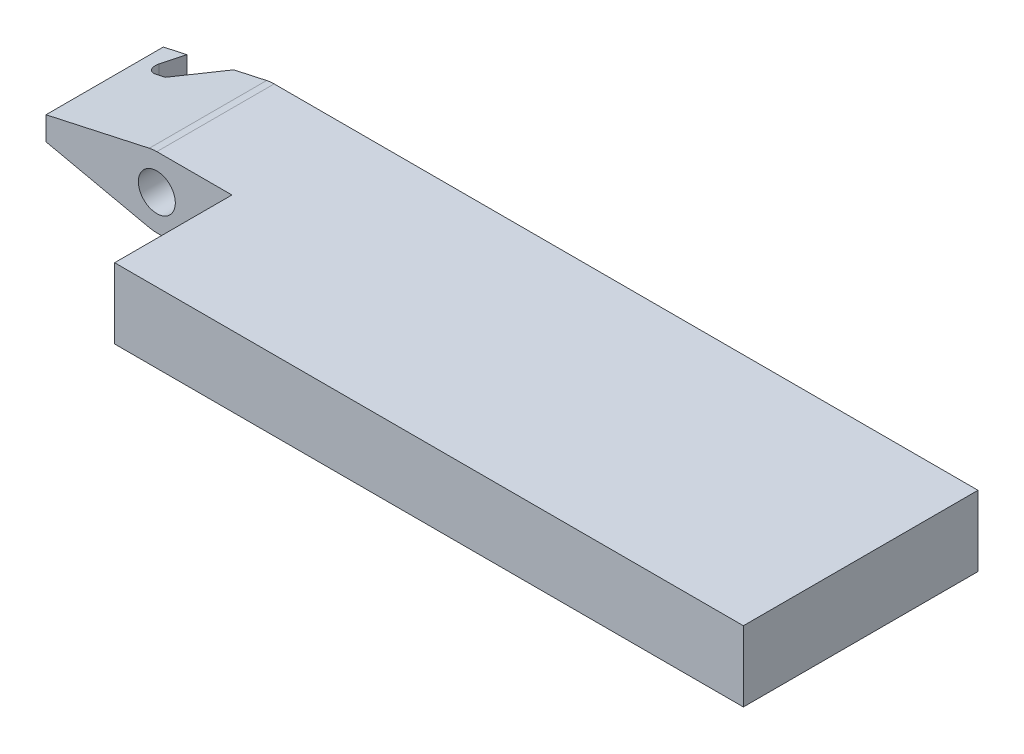
from build123d import *

# Parameters (mm, degrees)
SKETCH1_W           = 38.1
SKETCH1_H           = 12.7
BOSS_EXTRUDE1_DEPTH = 3.81
SKETCH2_W           = 4.064
SKETCH2_H           = 6.35
CUT_EXTRUDE1_DEPTH  = 41.341245643
SKETCH4_R           = 1
CUT_EXTRUDE2_DEPTH  = 41.341245643
SKETCH5_R           = 1
BOSS_EXTRUDE2_DEPTH = 6.35
CUT_EXTRUDE3_DEPTH  = 41.341245643
FILLET1_R           = 0.508


with BuildPart() as part:
    # Sketch1 → Boss-Extrude1 (new body)
    with BuildSketch(Plane(origin=(0, 0, 0), x_dir=(1, 0, 0), z_dir=(0, 1, 0))):
        with Locations((19.05, 6.35)):
            Rectangle(SKETCH1_W, SKETCH1_H)
    extrude(amount=BOSS_EXTRUDE1_DEPTH)

    # Sketch2 → Cut-Extrude1 (cut, through all)
    with BuildSketch(Plane(origin=(0, 3.81, 0), x_dir=(1, 0, 0), z_dir=(0, 1, 0))):
        with Locations((2.032, 3.175)):
            Rectangle(SKETCH2_W, SKETCH2_H)
    extrude(amount=-CUT_EXTRUDE1_DEPTH, mode=Mode.SUBTRACT)

    # Sketch4 → Cut-Extrude2 (cut, through all)
    with BuildSketch(Plane(origin=(0, 0, -12.7), x_dir=(-1, 0, 0), z_dir=(0, 0, -1))):
        with Locations((0, 1.905)):
            Circle(SKETCH4_R)
    extrude(amount=-CUT_EXTRUDE2_DEPTH, mode=Mode.SUBTRACT)

    # Sketch5 → Boss-Extrude2 (add)
    with BuildSketch(Plane(origin=(0, 0, -12.7), x_dir=(-1, 0, 0), z_dir=(0, 0, -1))):
        with BuildLine():
            Line((0.407900981, 3.765817506), (6, 2.54))
            Line((6, 2.54), (6, 1.27))
            Line((6, 1.27), (0.407900981, 0.044182494))
            ThreePointArc((0.407900981, 0.044182494), (-1.905, 1.905), (0.407900981, 3.765817506))
        make_face()
        with Locations((0, 1.905)):
            Circle(SKETCH5_R, mode=Mode.SUBTRACT)
    extrude(amount=-BOSS_EXTRUDE2_DEPTH)

    # Sketch6 → Cut-Extrude3 (cut, through all)
    with BuildSketch(Plane.XZ):
        Polygon((-4.73, -12.7), (-5.377139077, -10.922), (-4.107139077, -10.922), (-2.19, -12.7), align=None)
    extrude(amount=-CUT_EXTRUDE3_DEPTH, mode=Mode.SUBTRACT)

    # Fillet1
    fillet1_edges = [part.edges().sort_by_distance(p)[0] for p in [
        (-5.377139077, 1.905, -10.922),
    ]]
    fillet(fillet1_edges, radius=FILLET1_R)


solid = part.part
